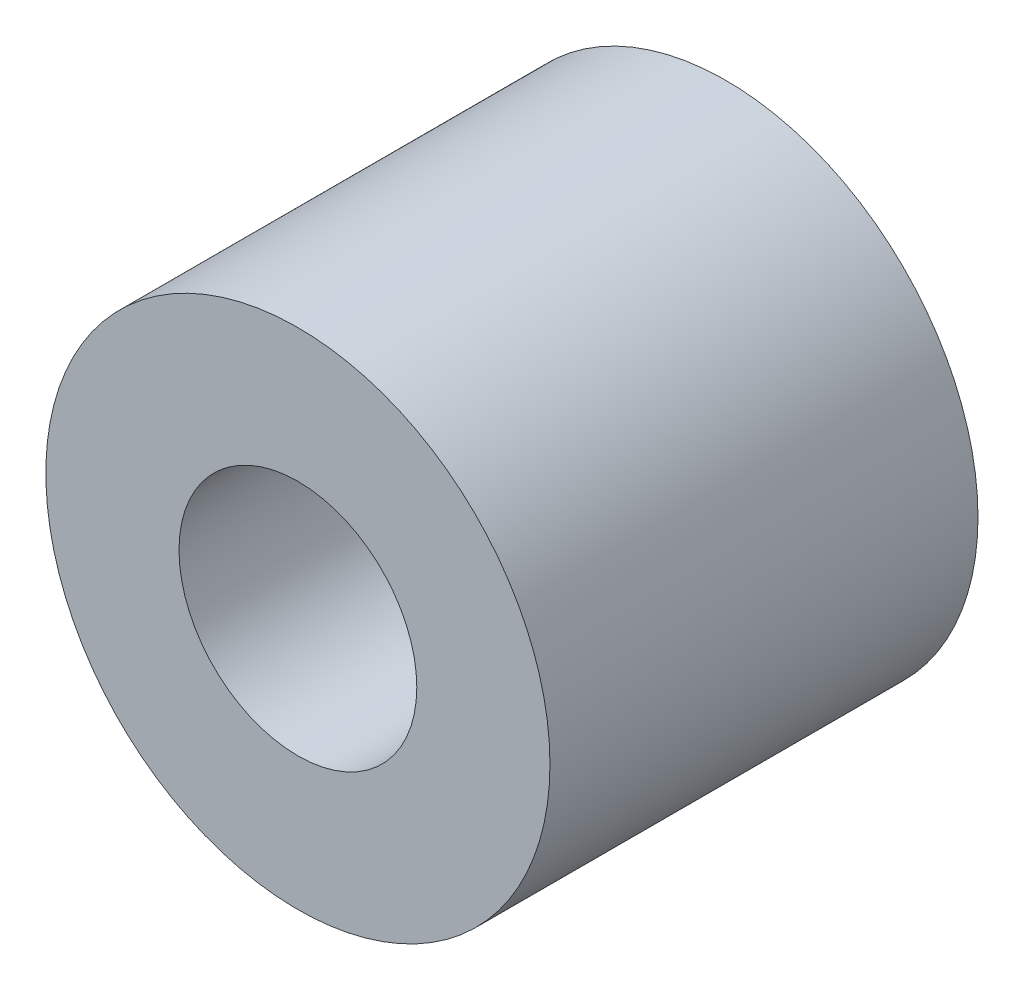
from build123d import *

# Parameters (mm, degrees)
SKETCH_1_R      = 265
SKETCH_1_R_2    = 125
EXTRUDE_1_DEPTH = 450


with BuildPart() as part:
    # Эскиз1 → Бобышка-Вытянуть1 (new body)
    with BuildSketch(Plane.XY):
        Circle(SKETCH_1_R)
        Circle(SKETCH_1_R_2, mode=Mode.SUBTRACT)
    extrude(amount=EXTRUDE_1_DEPTH)


solid = part.part
